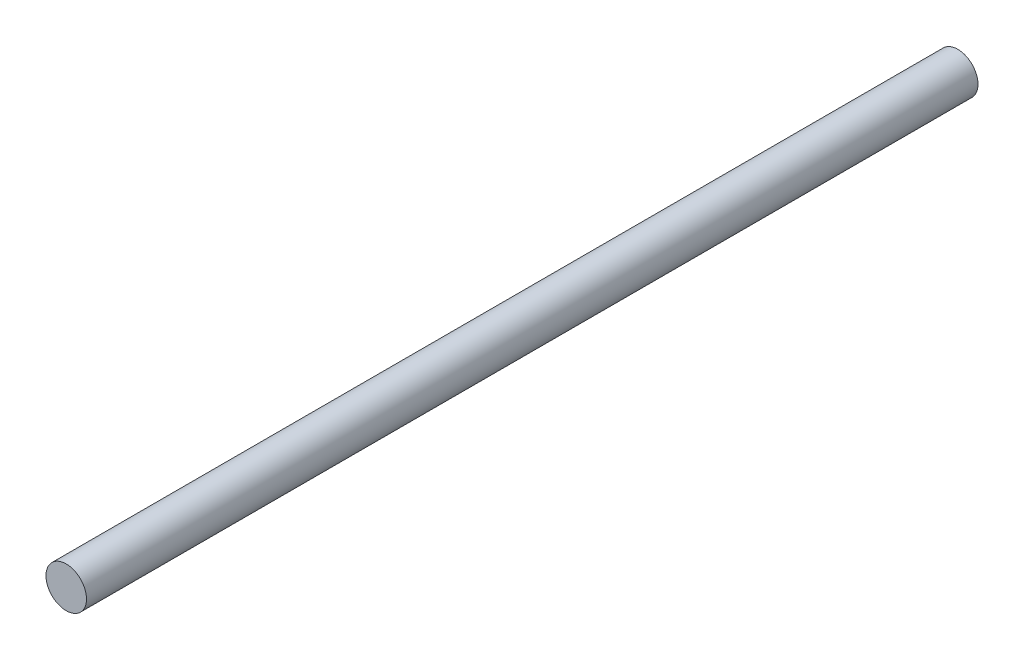
from build123d import *

# Parameters (mm, degrees)
CROQUIS1_R              = 12.5
SALIENTE_EXTRUIR1_DEPTH = 550


with BuildPart() as part:
    # Croquis1 → Saliente-Extruir1 (new body)
    with BuildSketch(Plane.XY):
        Circle(CROQUIS1_R)
    extrude(amount=SALIENTE_EXTRUIR1_DEPTH)


solid = part.part
